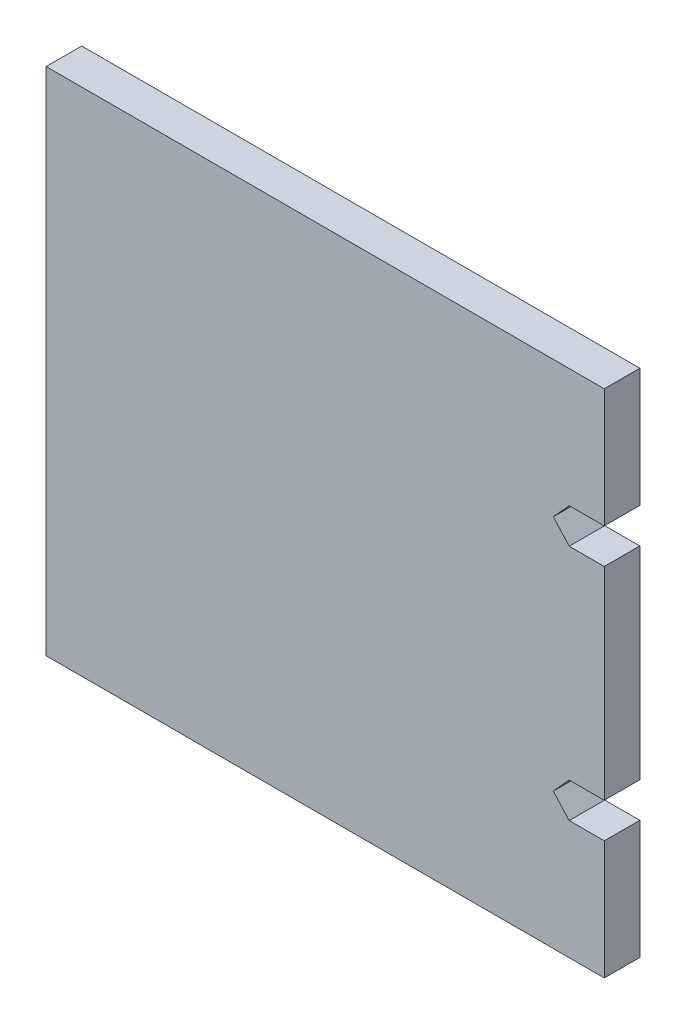
from build123d import *

# Parameters (mm, degrees)
ESBO_O1_W                = 350
ESBO_O1_H                = 320
RESSALTO_EXTRUS_O1_DEPTH = 22.3
CORTE_EXTRUS_O1_DEPTH    = 475.760244755


with BuildPart() as part:
    # Esboço1 → Ressalto-extrusão1 (new body)
    with BuildSketch(Plane.XY):
        with Locations((175, 160)):
            Rectangle(ESBO_O1_W, ESBO_O1_H)
    extrude(amount=RESSALTO_EXTRUS_O1_DEPTH)

    # Esboço2 → Corte-extrusão1 (cut, through all)
    with BuildSketch(Plane.XY.offset(22.3)):
        Polygon((318, 234.5), (328, 223.5), (350, 223.5), (350, 245.5), (328, 245.5), align=None)
        Polygon((328, 74.5), (318, 85.5), (328, 96.5), (350, 96.5), (350, 74.5), align=None)
    extrude(amount=-CORTE_EXTRUS_O1_DEPTH, mode=Mode.SUBTRACT)


solid = part.part
